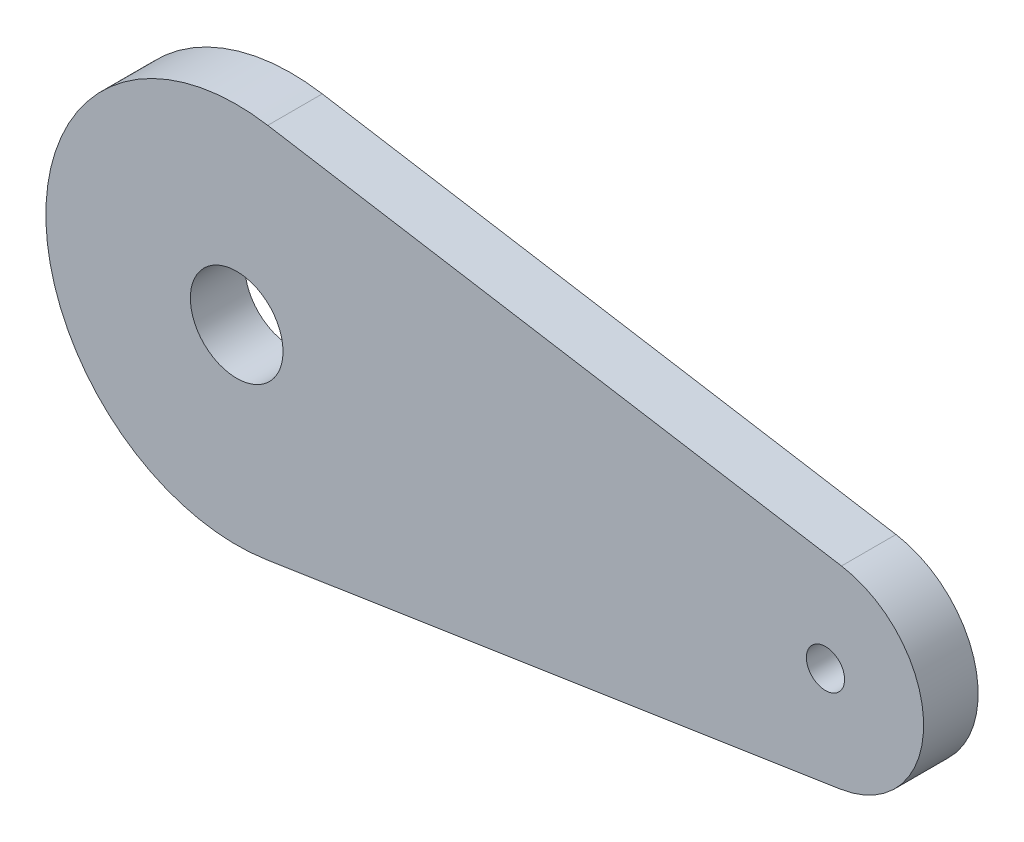
from build123d import *

# Parameters (mm, degrees)
SKETCH1_R           = 4.25
SKETCH1_R_2         = 1.75
BOSS_EXTRUDE1_DEPTH = 5


with BuildPart() as part:
    # Sketch1 → Boss-Extrude1 (new body)
    with BuildSketch(Plane.XY):
        with BuildLine():
            Line((-17.369421377, 74.846273527), (35.245178849, 66.159856367))
            ThreePointArc((35.245178849, 66.159856367), (42.77902815, 57.230068312), (35.146444748, 48.384523071))
            Line((35.146444748, 48.384523071), (-17.561404351, 40.283125451))
            ThreePointArc((-17.561404351, 40.283125451), (-37.719730042, 57.677203247), (-17.369421377, 74.846273527))
        make_face()
        with Locations((-20.22, 57.58)):
            Circle(SKETCH1_R, mode=Mode.SUBTRACT)
        with Locations((33.779166986, 57.280058553)):
            Circle(SKETCH1_R_2, mode=Mode.SUBTRACT)
    extrude(amount=-BOSS_EXTRUDE1_DEPTH)


solid = part.part
